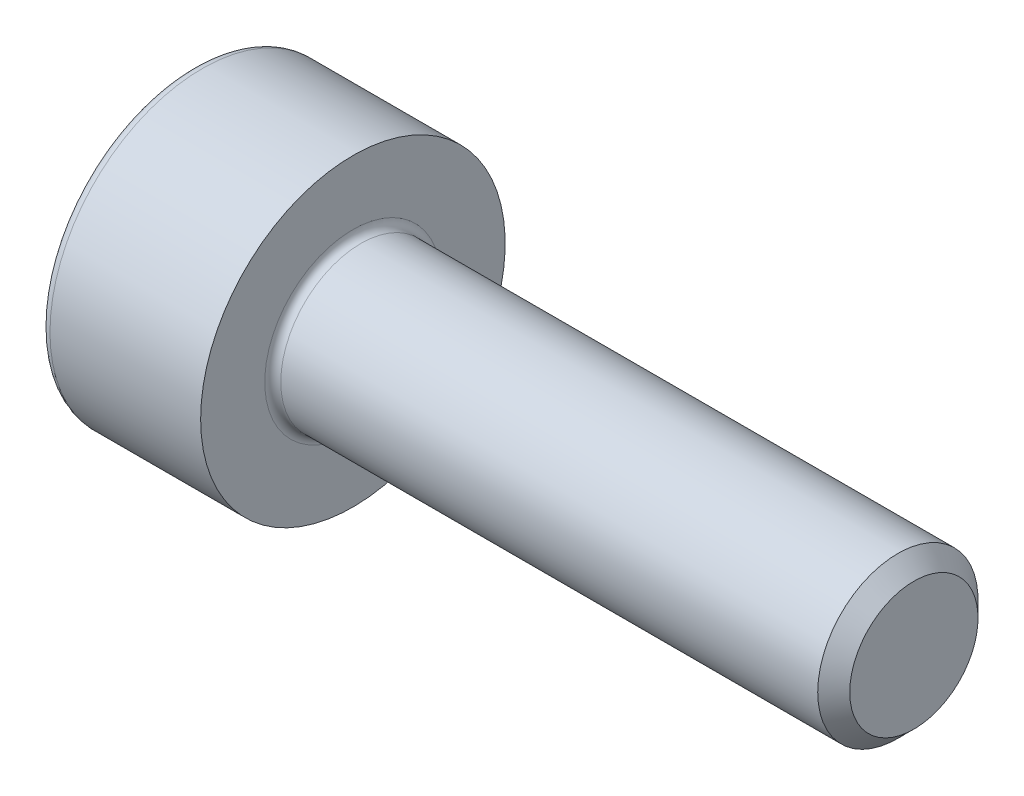
from build123d import *

# Parameters (mm, degrees)
FILLET1_R      = 0.1
FILLET2_R      = 0.12
CHAMFER1_SIZE  = 0.2
EXTRUDE1_DEPTH = 1


with BuildPart() as part:
    # Sketch1 → Revolve1 (revolve)
    with BuildSketch(Plane.XY, mode=Mode.PRIVATE) as revolve1_sk:
        Polygon((2, 1), (2, 0), (4.279914881, 0), (9, 0), (9, 1), align=None)
        Polygon((0, 1.9), (0, 0), (2, 0), (2, 1), (2, 1.9), align=None)
    revolve(revolve1_sk.sketch.rotate(Axis((0, 0, 0), (1, 0, 0)), 90), axis=Axis((0, 0, 0), (1, 0, 0)))

    # Fillet1
    fillet1_edges = [part.edges().sort_by_distance(p)[0] for p in [
        (2, 0, -1),
    ]]
    fillet(fillet1_edges, radius=FILLET1_R)

    # Fillet2
    fillet2_edges = [part.edges().sort_by_distance(p)[0] for p in [
        (0, 0, -1.9),
    ]]
    fillet(fillet2_edges, radius=FILLET2_R)

    # Chamfer1
    chamfer1_edges = [part.edges().sort_by_distance(p)[0] for p in [
        (9, 0, -1),
    ]]
    chamfer(chamfer1_edges, length=CHAMFER1_SIZE)

    # Sketch2 → Extrude1 (cut)
    with BuildSketch(Plane.ZY):
        Polygon((0, 0.866025404), (-0.75, 0.433012702), (-0.75, -0.433012702), (0, -0.866025404), (0.75, -0.433012702), (0.75, 0.433012702), align=None)
    extrude(amount=-EXTRUDE1_DEPTH, mode=Mode.SUBTRACT)


solid = part.part
